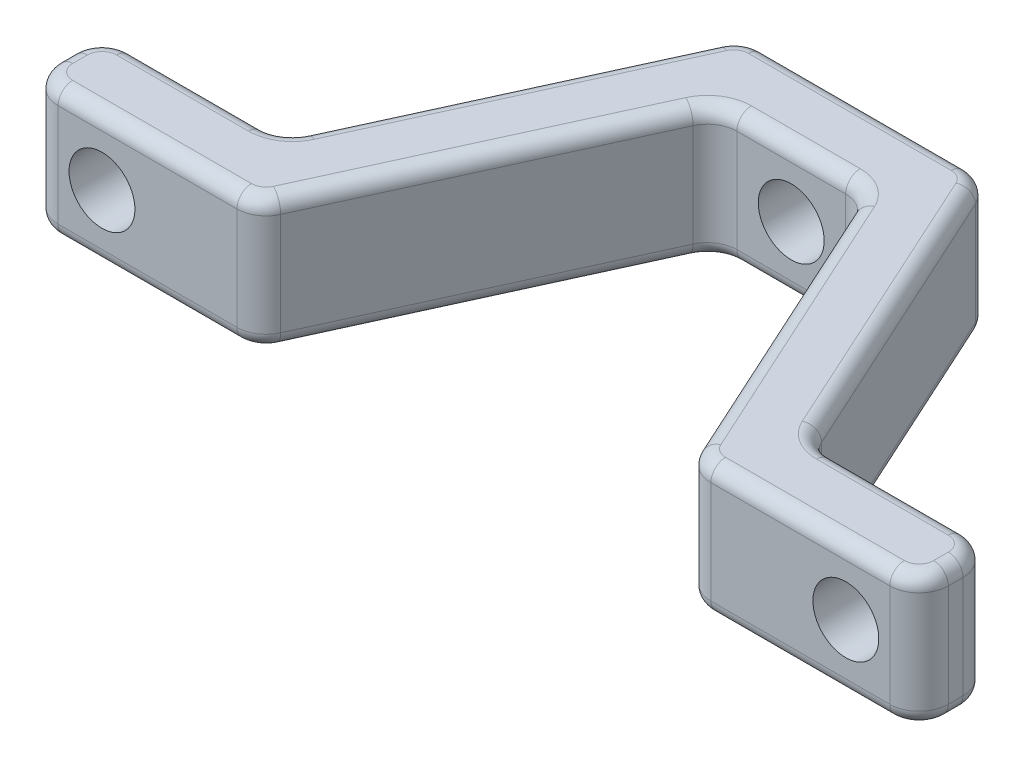
from build123d import *

# Parameters (mm, degrees)
BOSS_EXTRUDE1_DEPTH = 9
CUT_EXTRUDE1_REACH  = 43.43
SKETCH2_R           = 2.25
FILLET1_R           = 2
FILLET2_R           = 1


with BuildPart() as part:
    # Sketch1 → Boss-Extrude1 (new body)
    with BuildSketch(Plane(origin=(0, 0, 0), x_dir=(1, 0, 0), z_dir=(0, 1, 0))):
        Polygon((8.212454023, 0), (0, 0), (-8.212454023, 0), (-18.115120739, -21.67), (-20.4, -26.67), (-14.902666716, -26.67), (-5, -5), (5, -5), (14.902666716, -26.67), (20.4, -26.67), (18.115120739, -21.67), align=None)
        Polygon((-20.4, -26.67), (-18.115120739, -21.67), (-30.4, -21.67), (-30.4, -26.67), align=None)
        Polygon((30.4, -21.67), (18.115120739, -21.67), (20.4, -26.67), (30.4, -26.67), align=None)
    extrude(amount=BOSS_EXTRUDE1_DEPTH)

    # Sketch2 → Cut-Extrude1 (cut, up to next)
    with BuildSketch(Plane.XY, mode=Mode.PRIVATE) as cut_extrude1_sk1:
        with Locations(Location((0, 4.5, 0), (0, 0, 180))):
            Circle(SKETCH2_R)
    cut_extrude1_tool1 = extrude(cut_extrude1_sk1.sketch, amount=CUT_EXTRUDE1_REACH, mode=Mode.PRIVATE) & part.part
    # Sketch2 → Cut-Extrude1 (cut, up to next)
    with BuildSketch(Plane.XY, mode=Mode.PRIVATE) as cut_extrude1_sk2:
        with Locations(Location((25.4, 4.5, 0), (0, 0, 180))):
            Circle(SKETCH2_R)
    cut_extrude1_tool2 = extrude(cut_extrude1_sk2.sketch, amount=CUT_EXTRUDE1_REACH, mode=Mode.PRIVATE) & part.part
    # Sketch2 → Cut-Extrude1 (cut, up to next)
    with BuildSketch(Plane.XY, mode=Mode.PRIVATE) as cut_extrude1_sk3:
        with Locations(Location((-25.4, 4.5, 0), (0, 0, 180))):
            Circle(SKETCH2_R)
    cut_extrude1_tool3 = extrude(cut_extrude1_sk3.sketch, amount=CUT_EXTRUDE1_REACH, mode=Mode.PRIVATE) & part.part
    add(cut_extrude1_tool1.solids().sort_by_distance((0, 4.5, 0))[0], mode=Mode.SUBTRACT)
    add(cut_extrude1_tool2.solids().sort_by_distance((25.4, 4.5, 0))[0], mode=Mode.SUBTRACT)
    add(cut_extrude1_tool3.solids().sort_by_distance((-25.4, 4.5, 0))[0], mode=Mode.SUBTRACT)

    # Fillet1
    fillet1_edges = [part.edges().sort_by_distance(p)[0] for p in [
        (-5, 4.5, 5),
        (-14.902666716, 4.5, 26.67),
        (-30.4, 4.5, 26.67),
        (-30.4, 4.5, 21.67),
        (-18.115120739, 4.5, 21.67),
        (-8.212454023, 4.5, 0),
        (8.212454023, 4.5, 0),
        (18.115120739, 4.5, 21.67),
        (30.4, 4.5, 21.67),
        (30.4, 4.5, 26.67),
        (14.902666716, 4.5, 26.67),
        (5, 4.5, 5),
    ]]
    fillet(fillet1_edges, radius=FILLET1_R)

    # Fillet2
    fillet2_edges = [part.edges().sort_by_distance(p)[0] for p in [
        (0, 0, 5),
        (0, 9, 5),
        (-9.951333358, 0, 15.835),
        (-9.951333358, 9, 15.835),
        (-22.293824163, 0, 26.67),
        (-30.4, 0, 24.17),
        (-23.900051174, 0, 21.67),
        (-13.163787381, 0, 10.835),
        (0, 0, 0),
        (13.163787381, 0, 10.835),
        (23.900051174, 0, 21.67),
        (30.4, 0, 24.17),
        (22.293824163, 0, 26.67),
        (9.951333358, 0, 15.835),
        (15.106569342, 0, 26.352637285),
        (29.814213562, 0, 26.084213562),
        (29.814213562, 0, 22.255786438),
        (8.008551397, 0, 0.317362715),
        (-8.008551397, 0, 0.317362715),
        (-29.814213562, 0, 22.255786438),
        (-29.814213562, 0, 26.084213562),
        (-15.106569342, 0, 26.352637285),
        (-22.293824163, 9, 26.67),
        (9.951333358, 9, 15.835),
        (22.293824163, 9, 26.67),
        (30.4, 9, 24.17),
        (23.900051174, 9, 21.67),
        (13.163787381, 9, 10.835),
        (0, 9, 0),
        (-13.163787381, 9, 10.835),
        (-23.900051174, 9, 21.67),
        (-30.4, 9, 24.17),
        (15.106569342, 9, 26.352637285),
        (29.814213562, 9, 26.084213562),
        (29.814213562, 9, 22.255786438),
        (8.008551397, 9, 0.317362715),
        (-8.008551397, 9, 0.317362715),
        (-29.814213562, 9, 22.255786438),
        (-29.814213562, 9, 26.084213562),
        (-15.106569342, 9, 26.352637285),
        (-4.796097374, 0, 5.317362715),
        (-4.796097374, 9, 5.317362715),
        (-18.319023366, 0, 21.352637285),
        (-18.319023366, 9, 21.352637285),
        (18.319023366, 0, 21.352637285),
        (18.319023366, 9, 21.352637285),
        (4.796097374, 0, 5.317362715),
        (4.796097374, 9, 5.317362715),
    ]]
    fillet(fillet2_edges, radius=FILLET2_R)


solid = part.part
